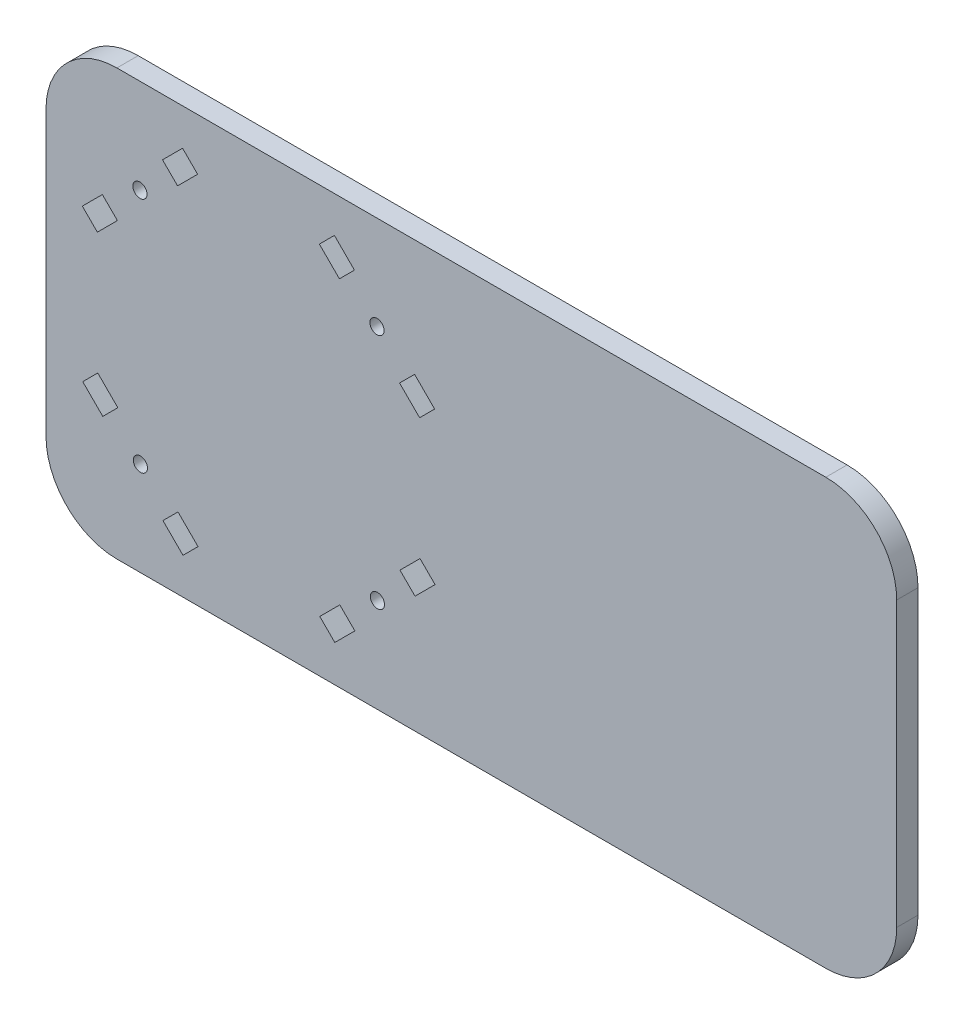
from build123d import *

# Parameters (mm, degrees)
BOSS_EXTRU_1_DEPTH           = 15
ESQUISSE3_R                  = 5
ENL_V_MAT_EXTRU_1_DEPTH      = 390.991583511
R_P_TITION_CIRCULAIRE1_COUNT = 4


with BuildPart() as part:
    # Esquisse1 → Boss.-Extru.1 (new body)
    with BuildSketch(Plane.XY):
        with BuildLine():
            ThreePointArc((-359.678238443, -100), (-345.033577502, -135.355339059), (-309.678238443, -150))
            Line((-309.678238443, -150), (190.321761557, -150))
            ThreePointArc((190.321761557, -150), (225.677100616, -135.355339059), (240.321761557, -100))
            Line((240.321761557, -100), (240.321761557, 100))
            ThreePointArc((240.321761557, 100), (225.677100616, 135.355339059), (190.321761557, 150))
            Line((190.321761557, 150), (-309.678238443, 150))
            ThreePointArc((-309.678238443, 150), (-345.033577502, 135.355339059), (-359.678238443, 100))
            Line((-359.678238443, 100), (-359.678238443, -100))
        make_face()
    extrude(amount=BOSS_EXTRU_1_DEPTH)

    # Esquisse3 → Enlèv. mat.-Extru.1 (cut, through all)
    with BuildSketch(Plane.XY.offset(15)):
        with Locations((-293.418714055, 83.447366527)):
            Circle(ESQUISSE3_R)
        Polygon((-263.366675854, 124.106006445), (-252.760074137, 113.499404727), (-266.90220976, 99.357269104), (-277.508811478, 109.963870821), align=None)
        Polygon((-309.328616632, 56.930862233), (-319.935218349, 67.53746395), (-334.077353973, 53.395328327), (-323.470752255, 42.788726609), align=None)
    enl_v_mat_extru_1 = extrude(amount=-ENL_V_MAT_EXTRU_1_DEPTH, mode=Mode.SUBTRACT)

    # Répétition circulaire1: Enlèv. mat.-Extru.1 ×4 about axis
    r_p_tition_circulaire1_axis = Axis((-209.678238443, 0, 15), (0, 0, -1))
    for i in range(1, R_P_TITION_CIRCULAIRE1_COUNT):
        add(enl_v_mat_extru_1.rotate(r_p_tition_circulaire1_axis, i * 360 / R_P_TITION_CIRCULAIRE1_COUNT), mode=Mode.SUBTRACT)


solid = part.part
